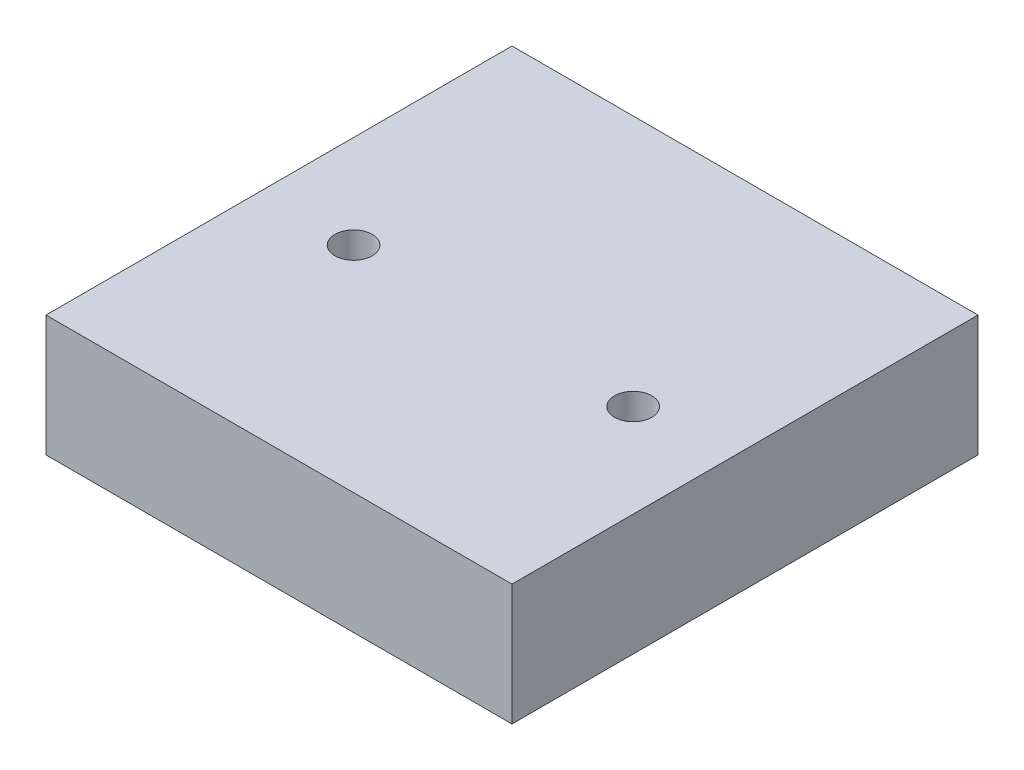
from build123d import *

# Parameters (mm, degrees)
SKETCH_1_W          = 50
SKETCH_1_H          = 50
EXTRUDE_1_DEPTH     = 13
CUT_EXTRUDE_1_REACH = 39.67
SKETCH_3_R          = 2


with BuildPart() as part:
    # 草图1 → 凸台-拉伸1 (new body)
    with BuildSketch(Plane(origin=(0, 0, 0), x_dir=(1, 0, 0), z_dir=(0, 1, 0))):
        Rectangle(SKETCH_1_W, SKETCH_1_H)
    extrude(amount=EXTRUDE_1_DEPTH)

    # 草图3 → 切除-拉伸1 (cut, up to next)
    with BuildSketch(Plane(origin=(0, 13, 0), x_dir=(1, 0, 0), z_dir=(0, 1, 0)), mode=Mode.PRIVATE) as cut_extrude_1_sk1:
        with Locations(Location((-15, -2, 0), (0, 0, 270))):
            Circle(SKETCH_3_R)
    cut_extrude_1_tool1 = extrude(cut_extrude_1_sk1.sketch, amount=-CUT_EXTRUDE_1_REACH, mode=Mode.PRIVATE) & part.part
    # 草图3 → 切除-拉伸1 (cut, up to next)
    with BuildSketch(Plane(origin=(0, 13, 0), x_dir=(1, 0, 0), z_dir=(0, 1, 0)), mode=Mode.PRIVATE) as cut_extrude_1_sk2:
        with Locations(Location((15, -2, 0), (0, 0, 270))):
            Circle(SKETCH_3_R)
    cut_extrude_1_tool2 = extrude(cut_extrude_1_sk2.sketch, amount=-CUT_EXTRUDE_1_REACH, mode=Mode.PRIVATE) & part.part
    add(cut_extrude_1_tool1.solids().sort_by_distance((-15, 13, 2))[0], mode=Mode.SUBTRACT)
    add(cut_extrude_1_tool2.solids().sort_by_distance((15, 13, 2))[0], mode=Mode.SUBTRACT)


solid = part.part
